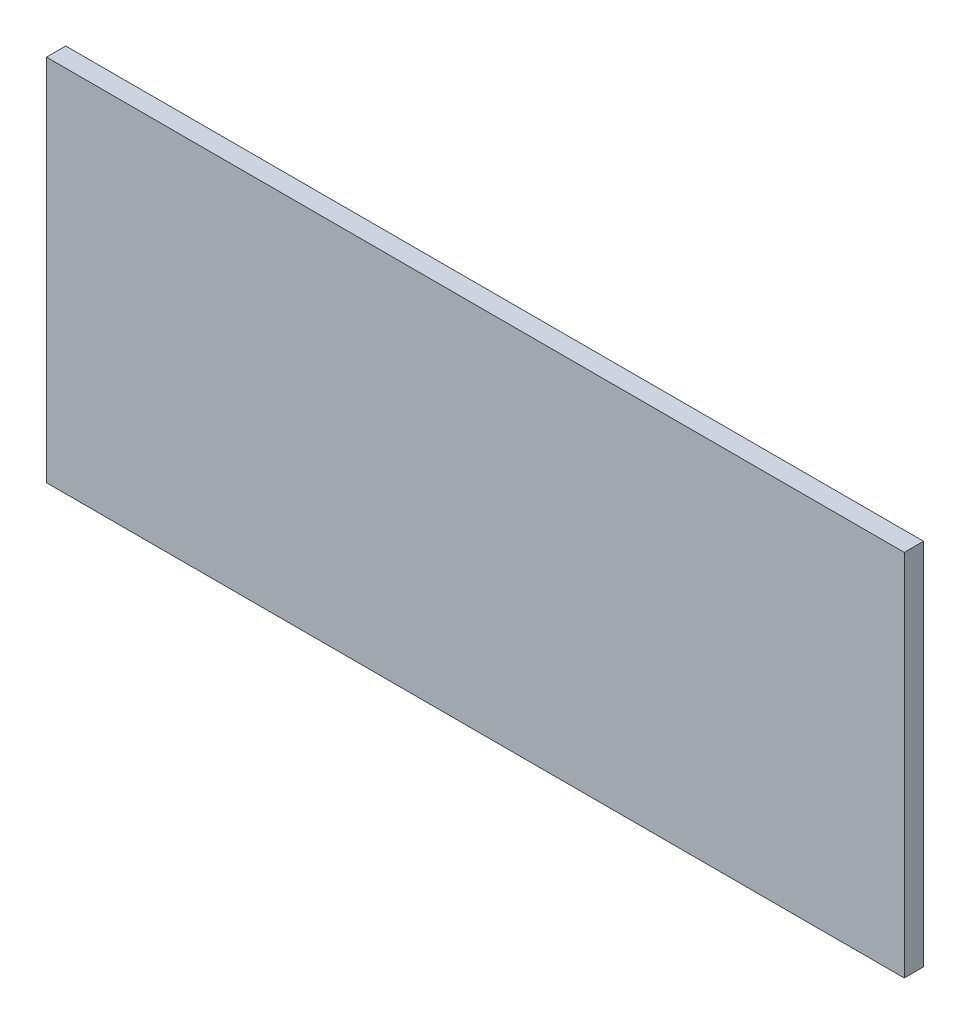
from build123d import *

# Parameters (mm, degrees)
SKETCH1_W           = 70.104
SKETCH1_H           = 30.1244
BOSS_EXTRUDE1_DEPTH = 1.5748


with BuildPart() as part:
    # Sketch1 → Boss-Extrude1 (new body)
    with BuildSketch(Plane.XY):
        Rectangle(SKETCH1_W, SKETCH1_H)
    extrude(amount=BOSS_EXTRUDE1_DEPTH)


solid = part.part
